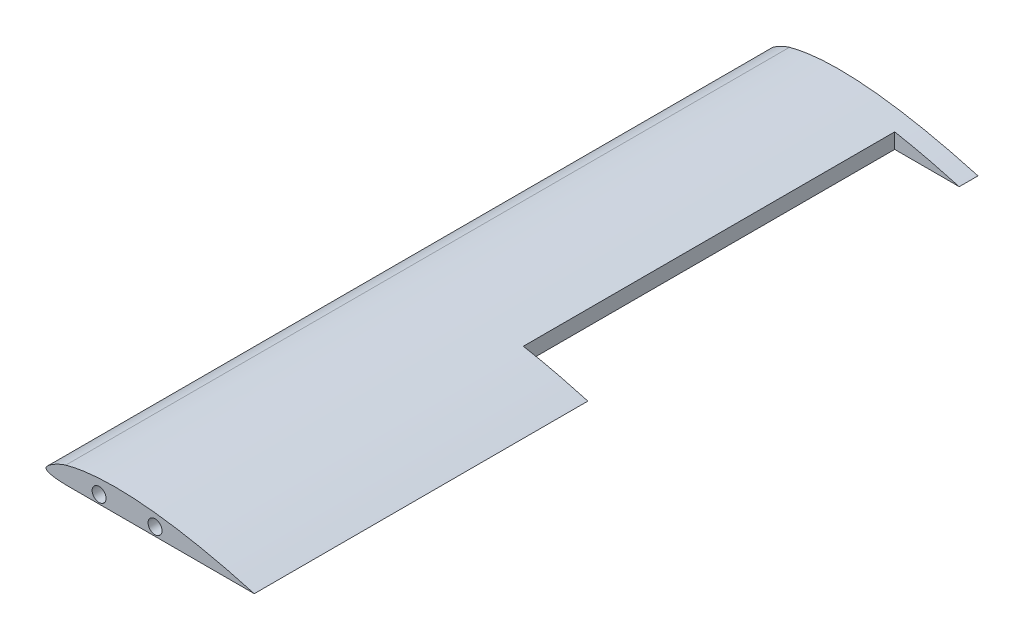
from build123d import *

# Parameters (mm, degrees)
EXTRUDE_1_DEPTH = 520
SKETCH_2_R      = 5
EXTRUDE_2_DEPTH = 200
SKETCH_3_W      = 100
SKETCH_3_H      = 25
EXTRUDE_3_DEPTH = 35
EXTRUDE_5_DEPTH = 537.660389604
SKETCH_5_W      = 100
SKETCH_5_H      = 35
SKETCH_5_R      = 5
EXTRUDE_6_DEPTH = 365.177154824
SKETCH_6_W      = 46.372751661
SKETCH_6_H      = 266.817106028
EXTRUDE_7_DEPTH = 543.033209438
SKETCH_7_W      = 2
SKETCH_7_H      = 2
EXTRUDE_8_DEPTH = 8


with BuildPart() as part:
    # Эскиз1 → Выдавливание1 (new body)
    with BuildSketch(Plane.XY):
        with BuildLine():
            Line((17.216759952, 0), (24.157065095, 0))
            Line((24.157065095, 0), (150, 0))
            add(Edge.make_bspline(
                [(150, 0), (149.81030361, 0.053529617), (148.882201468, 0.315032337), (147.214807613, 0.781161069), (144.638992179, 1.491126094), (142.800374455, 1.988440996), (141.318340661, 2.384573546), (139.452754799, 2.881127143), (136.676837397, 3.60461154), (134.280306387, 4.211858432), (132.792106382, 4.584811685), (129.235813394, 5.46974053), (123.652440035, 6.797759966), (118.633131672, 7.910034679), (115.633209291, 8.554290821), (112.826991836, 9.14774681), (110.015289351, 9.715279489), (107.003478198, 10.303301487), (104.185223481, 10.841681269), (101.361556105, 11.351776466), (98.339129081, 11.878596065), (93.939117131, 12.622208256), (88.274300406, 13.479712404), (83.978181221, 14.048760672), (80.940191222, 14.433479778), (78.097651877, 14.770202545), (75.250798587, 15.067698456), (72.203853845, 15.36942512), (69.352048191, 15.622870882), (66.495757502, 15.831470209), (63.438664304, 16.039316694), (60.577734283, 16.197706139), (57.709244977, 16.303860565), (56.174698043, 16.35378285), (54.738764009, 16.392329985), (53.302855383, 16.416586442), (51.767789961, 16.436234823), (50.33339422, 16.444728865), (48.900971922, 16.437830659), (45.840467882, 16.411910759), (42.983315883, 16.330424119), (40.134450484, 16.176120437), (38.613933889, 16.08991393), (35.852762791, 15.90171105), (33.017426128, 15.63011911), (29.998812251, 15.287348394), (27.091876231, 14.907864343), (24.278899318, 14.440588093), (22.036305082, 14.023508093), (20.441331811, 13.707675659), (18.107266882, 13.188271141), (16.253542661, 12.729723055), (15.054906131, 12.409514194), (14.596518451, 12.282817756), (14.507482762, 12.258173389)],
                knots=[0, 0, 0, 0, 0.000555866, 0.002719331, 0.00488283, 0.008091744, 0.008091744, 0.009209962, 0.013537252, 0.016183489, 0.016183489, 0.017864641, 0.026519981, 0.032366977, 0.032366977, 0.035175545, 0.040458721, 0.040458721, 0.043830604, 0.048550466, 0.048550466, 0.052486232, 0.061141801, 0.064733954, 0.064733954, 0.069797301, 0.072825699, 0.072825699, 0.078452599, 0.080917443, 0.080917443, 0.087108681, 0.089009187, 0.089009187, 0.091435537, 0.093055059, 0.093055059, 0.09576276, 0.097100931, 0.097100931, 0.104410088, 0.105192676, 0.105192676, 0.108730151, 0.113047596, 0.11328442, 0.117362056, 0.121376164, 0.121376164, 0.12382745, 0.125980715, 0.128132921, 0.1292086, 0.129467908, 0.129467908, 0.129467908, 0.129467908], degree=3, weights=[1, 1, 1, 1, 1, 1, 1, 1, 1, 1, 1, 1, 1, 1, 1, 1, 1, 1, 1, 1, 1, 1, 1, 1, 1, 1, 1, 1, 1, 1, 1, 1, 1, 1, 1, 1, 1, 1, 1, 1, 1, 1, 1, 1, 1, 1, 1, 1, 1, 1, 1, 1, 1, 1, 1]))
            add(Edge.make_bspline(
                [(14.507482762, 12.258173389), (14.487535807, 12.253898122), (14.446901688, 12.245220345), (14.385711643, 12.231650532), (14.303323577, 12.212444955), (14.200681249, 12.186989009), (14.098438631, 12.15982399), (14.016898043, 12.137249748), (13.915594175, 12.1084723), (13.814201179, 12.078206173), (13.673769841, 12.034701594), (13.593697027, 12.009155218), (13.432189325, 11.956946018), (13.168840213, 11.869276948), (12.851499095, 11.757953312), (12.636467156, 11.679370184), (12.476593809, 11.620373962), (12.212445703, 11.521100357), (11.89945243, 11.398610607), (11.691220728, 11.315054079), (11.375765339, 11.18772747), (11.066249956, 11.058931166), (10.492323582, 10.812623104), (9.872212798, 10.53818667), (9.26638551, 10.255649662), (8.656258776, 9.96250305), (8.049423519, 9.663202301), (7.184923771, 9.215047291), (6.295104741, 8.727951549), (5.689978236, 8.376606344), (5.109666388, 8.027672554), (4.805937474, 7.839021656), (4.255159191, 7.483991103), (3.9610075, 7.287159116), (3.418058589, 6.907242806), (3.134040966, 6.699410672), (2.866989333, 6.492559067), (2.731726174, 6.387611968), (2.471438274, 6.180098709), (2.214619815, 5.961648166), (1.956759113, 5.733211183), (1.705506744, 5.50150004), (1.46926257, 5.261855665), (1.240445885, 5.01505543), (1.129715779, 4.888106001), (0.969198775, 4.687629252), (0.865778278, 4.552533175), (0.766728544, 4.409119764), (0.673356013, 4.264275974), (0.586265645, 4.118650705), (0.512652982, 3.969590756), (0.478206777, 3.890340257), (0.444441655, 3.811916491), (0.412149098, 3.724806261), (0.366526669, 3.566200236), (0.349365308, 3.482715473), (0.340871887, 3.396609769), (0.33636387, 3.34539112), (0.334950653, 3.271574435), (0.341818611, 3.194627296), (0.346855477, 3.160931387), (0.350505672, 3.139655787), (0.356181258, 3.109410374), (0.36625473, 3.067820677), (0.376112671, 3.035460297), (0.382899505, 3.014736516), (0.389912925, 2.994482377), (0.397670475, 2.974576502), (0.410253872, 2.944088059), (0.423354344, 2.915374275), (0.442613181, 2.877597263), (0.468010627, 2.83121116), (0.507556263, 2.768278917), (0.545243104, 2.717154575), (0.571834155, 2.683110592), (0.598343044, 2.649916419), (0.626246816, 2.61762498), (0.655413064, 2.585575163), (0.684498891, 2.554243039), (0.714610864, 2.523903985), (0.745637224, 2.493908873), (0.807535949, 2.435098484), (0.872617946, 2.379869398), (0.940536364, 2.326566353), (1.007934797, 2.274453715), (1.077407324, 2.225273737), (1.148832484, 2.177359309), (1.290264122, 2.083620806), (1.436560263, 1.999067792), (1.588349921, 1.919283473), (1.738535562, 1.841193672), (1.892403939, 1.769308367), (2.050265242, 1.700911073), (2.20628331, 1.633975521), (2.384215444, 1.563964929), (2.706615172, 1.446168585), (3.027274043, 1.338740204), (3.35571904, 1.241470547), (3.821869859, 1.111603171), (4.180585902, 1.023440761), (4.816802437, 0.882674339), (5.183046452, 0.810198297), (5.818229351, 0.69613406), (6.189696112, 0.63595021), (6.822187658, 0.542624491), (7.199172939, 0.492219044), (7.828835302, 0.415461616), (8.211029381, 0.373200208), (9.172389252, 0.276317664), (9.899956169, 0.216681888), (11.195873861, 0.129287928), (11.86863414, 0.093265995), (12.550927742, 0.063683748), (12.957817255, 0.046442251), (13.631679505, 0.021961472), (14.240407544, 0.006194819), (14.507482762, 0)],
                knots=[-5.0221e-05, -5.0221e-05, -5.0221e-05, -5.0221e-05, 9.89e-06, 7.2253e-05, 0.000134646, 0.000259546, 0.000384605, 0.000447404, 0.000509819, 0.000696217, 0.000760615, 0.00094503, 0.00094503, 0.001263048, 0.0017664, 0.00194028, 0.00194028, 0.002270596, 0.002774741, 0.002935531, 0.002935531, 0.003783077, 0.003930782, 0.004791541, 0.005799916, 0.005921284, 0.006808306, 0.007816726, 0.008825151, 0.009833547, 0.009902288, 0.010841943, 0.010897539, 0.011850382, 0.01189279, 0.012858708, 0.012888041, 0.012888041, 0.013363116, 0.01386718, 0.013883292, 0.014380917, 0.014878543, 0.014878543, 0.015376168, 0.015376168, 0.01563167, 0.015873794, 0.015883999, 0.016136254, 0.016371419, 0.016371419, 0.016388151, 0.016620232, 0.016640294, 0.016869045, 0.016869045, 0.016892438, 0.017018717, 0.017081646, 0.017117858, 0.017117858, 0.017144357, 0.017207265, 0.017242264, 0.017242264, 0.017270606, 0.017304467, 0.017304467, 0.01736667, 0.017396538, 0.017428873, 0.017522178, 0.017615483, 0.017615483, 0.017648776, 0.017739889, 0.017739889, 0.01777503, 0.017864296, 0.017864296, 0.017900696, 0.018113108, 0.018113108, 0.018152853, 0.018361921, 0.018361921, 0.018404983, 0.018859547, 0.018859547, 0.018909198, 0.019357172, 0.019357172, 0.019413511, 0.019854798, 0.019917582, 0.020421774, 0.020850049, 0.020926014, 0.0218453, 0.021934536, 0.02284055, 0.022942807, 0.023835801, 0.023951243, 0.024831052, 0.02495962, 0.025826303, 0.025968008, 0.027816805, 0.027984762, 0.029807307, 0.029807307, 0.030001509, 0.031009895, 0.031797809, 0.031797809, 0.031797809, 0.031797809], degree=3, weights=[1, 1, 1, 1, 1, 1, 1, 1, 1, 1, 1, 1, 1, 1, 1, 1, 1, 1, 1, 1, 1, 1, 1, 1, 1, 1, 1, 1, 1, 1, 1, 1, 1, 1, 1, 1, 1, 1, 1, 1, 1, 1, 1, 1, 1, 1, 1, 1, 1, 1, 1, 1, 1, 1, 1, 1, 1, 1, 1, 1, 1, 1, 1, 1, 1, 1, 1, 1, 1, 1, 1, 1, 1, 1, 1, 1, 1, 1, 1, 1, 1, 1, 1, 1, 1, 1, 1, 1, 1, 1, 1, 1, 1, 1, 1, 1, 1, 1, 1, 1, 1, 1, 1, 1, 1, 1, 1, 1, 1, 1, 1, 1, 1, 1, 1, 1, 1]))
            ThreePointArc((14.507482762, 0), (15.862121357, -0.015708333), (17.216759952, 0))
        make_face()
    extrude(amount=EXTRUDE_1_DEPTH)

    # Эскиз2 → Выдавливание2 (cut)
    with BuildSketch(Plane.XY.offset(520)):
        with Locations((78.700854972, 6)):
            Circle(SKETCH_2_R)
        with Locations((38.500824114, 6)):
            Circle(SKETCH_2_R)
    extrude(amount=-EXTRUDE_2_DEPTH, mode=Mode.SUBTRACT)

    # Эскиз3 → Выдавливание3 (add)
    with BuildSketch(Plane.XZ):
        with Locations((78.318296192, 317.5)):
            Rectangle(SKETCH_3_W, SKETCH_3_H)
    extrude(amount=EXTRUDE_3_DEPTH)

    # Эскиз4 → Выдавливание5 (cut, through all)
    with BuildSketch(Plane(origin=(128.318296192, 0, 0), x_dir=(0, 0, -1), z_dir=(1, 0, 0))):
        with BuildLine():
            Line((-327.5, -25), (-327.5, -35))
            Line((-327.5, -35), (-307.5, -35))
            Line((-307.5, -35), (-307.5, -25))
            Line((-307.5, -25), (-307.5, -15))
            ThreePointArc((-307.5, -15), (-317.5, -5), (-327.5, -15))
            Line((-327.5, -15), (-327.5, -25))
        make_face()
    extrude(amount=-EXTRUDE_5_DEPTH, mode=Mode.SUBTRACT)

    # Эскиз5 → Выдавливание6 (cut, through all)
    with BuildSketch(Plane.XY.offset(330)):
        with Locations((78.318296192, -17.5)):
            Rectangle(SKETCH_5_W, SKETCH_5_H)
        with Locations((58.318296192, -25)):
            Circle(SKETCH_5_R, mode=Mode.SUBTRACT)
        with Locations((78.318296192, -25)):
            Circle(SKETCH_5_R, mode=Mode.SUBTRACT)
        with Locations((98.318296192, -25)):
            Circle(SKETCH_5_R, mode=Mode.SUBTRACT)
    extrude(amount=-EXTRUDE_6_DEPTH, mode=Mode.SUBTRACT)


with BuildPart() as extrude_6_piece_1:
    # of the separate pieces the step leaves, piece 1, a body of its own (extrude_6_pieces)
    add(part.part.solids().sort_by_distance((17.216759952, 0, 0))[0])

    # Эскиз6 → Выдавливание7 (cut, through all)
    with BuildSketch(Plane.XZ):
        with Locations((126.81362417, 146.885242674)):
            Rectangle(SKETCH_6_W, SKETCH_6_H)
    extrude(amount=-EXTRUDE_7_DEPTH, mode=Mode.SUBTRACT)

    # Эскиз7 → Выдавливание8 (add)
    with BuildSketch(Plane.XZ):
        with Locations((102.627248339, 26.885242674)):
            Rectangle(SKETCH_7_W, SKETCH_7_H)
        with Locations((102.627248339, 46.885242674)):
            Rectangle(SKETCH_7_W, SKETCH_7_H)
        with Locations((102.627248339, 36.885242674)):
            Rectangle(SKETCH_7_W, SKETCH_7_H)
        with Locations((102.627248339, 56.885242674)):
            Rectangle(SKETCH_7_W, SKETCH_7_H)
        with Locations((102.627248339, 66.885242674)):
            Rectangle(SKETCH_7_W, SKETCH_7_H)
        with Locations((102.627248339, 76.885242674)):
            Rectangle(SKETCH_7_W, SKETCH_7_H)
        with Locations((102.627248339, 86.885242674)):
            Rectangle(SKETCH_7_W, SKETCH_7_H)
        with Locations((102.627248339, 96.885242674)):
            Rectangle(SKETCH_7_W, SKETCH_7_H)
        with Locations((102.627248339, 106.885242674)):
            Rectangle(SKETCH_7_W, SKETCH_7_H)
        with Locations((102.627248339, 116.885242674)):
            Rectangle(SKETCH_7_W, SKETCH_7_H)
        with Locations((102.627248339, 126.885242674)):
            Rectangle(SKETCH_7_W, SKETCH_7_H)
        with Locations((102.627248339, 146.885242674)):
            Rectangle(SKETCH_7_W, SKETCH_7_H)
        with Locations((102.627248339, 136.885242674)):
            Rectangle(SKETCH_7_W, SKETCH_7_H)
        with Locations((102.627248339, 156.885242674)):
            Rectangle(SKETCH_7_W, SKETCH_7_H)
        with Locations((102.627248339, 166.885242674)):
            Rectangle(SKETCH_7_W, SKETCH_7_H)
        with Locations((102.627248339, 176.885242674)):
            Rectangle(SKETCH_7_W, SKETCH_7_H)
        with Locations((102.627248339, 186.885242674)):
            Rectangle(SKETCH_7_W, SKETCH_7_H)
        with Locations((102.627248339, 196.885242674)):
            Rectangle(SKETCH_7_W, SKETCH_7_H)
        with Locations((102.627248339, 206.885242674)):
            Rectangle(SKETCH_7_W, SKETCH_7_H)
        with Locations((102.627248339, 216.885242674)):
            Rectangle(SKETCH_7_W, SKETCH_7_H)
        with Locations((102.627248339, 226.885242674)):
            Rectangle(SKETCH_7_W, SKETCH_7_H)
        with Locations((102.627248339, 236.885242674)):
            Rectangle(SKETCH_7_W, SKETCH_7_H)
        with Locations((102.627248339, 246.885242674)):
            Rectangle(SKETCH_7_W, SKETCH_7_H)
        with Locations((102.627248339, 256.885242674)):
            Rectangle(SKETCH_7_W, SKETCH_7_H)
        with Locations((102.627248339, 266.885242674)):
            Rectangle(SKETCH_7_W, SKETCH_7_H)
    extrude(amount=-EXTRUDE_8_DEPTH)


with BuildPart() as extrude_6_piece_2:
    # of the separate pieces the step leaves, piece 2, a body of its own (extrude_6_pieces)
    add(part.part.solids().sort_by_distance((63.318296192, -25, 305))[0])


with BuildPart() as extrude_6_piece_3:
    # of the separate pieces the step leaves, piece 3, a body of its own (extrude_6_pieces)
    add(part.part.solids().sort_by_distance((83.318296192, -25, 305))[0])


with BuildPart() as extrude_6_piece_4:
    # of the separate pieces the step leaves, piece 4, a body of its own (extrude_6_pieces)
    add(part.part.solids().sort_by_distance((103.318296192, -25, 305))[0])


with BuildPart() as extrude_6_piece_5:
    # of the separate pieces the step leaves, piece 5, a body of its own (extrude_6_pieces)
    add(part.part.solids().sort_by_distance((63.318296192, -25, 330))[0])


with BuildPart() as extrude_6_piece_6:
    # of the separate pieces the step leaves, piece 6, a body of its own (extrude_6_pieces)
    add(part.part.solids().sort_by_distance((83.318296192, -25, 330))[0])


with BuildPart() as extrude_6_piece_7:
    # of the separate pieces the step leaves, piece 7, a body of its own (extrude_6_pieces)
    add(part.part.solids().sort_by_distance((103.318296192, -25, 330))[0])


solid = Compound([extrude_6_piece_1.part, extrude_6_piece_2.part, extrude_6_piece_3.part, extrude_6_piece_4.part, extrude_6_piece_5.part, extrude_6_piece_6.part, extrude_6_piece_7.part])
